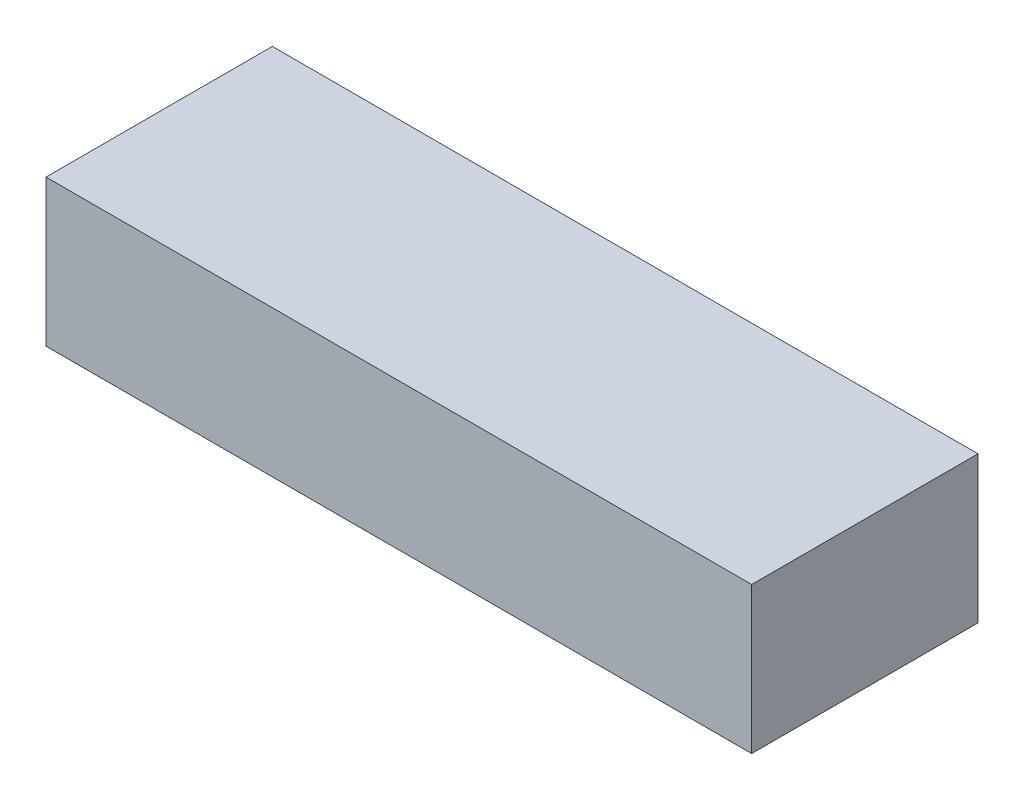
from build123d import *

# Parameters (mm, degrees)
SKETCH1_W          = 106
SKETCH1_H          = 34
BATTERY_MOCK_DEPTH = 22


with BuildPart() as part:
    # Sketch1 → battery_mock (new body)
    with BuildSketch(Plane(origin=(0, 0, 0), x_dir=(1, 0, 0), z_dir=(0, 1, 0))):
        Rectangle(SKETCH1_W, SKETCH1_H)
    extrude(amount=BATTERY_MOCK_DEPTH)


solid = part.part
